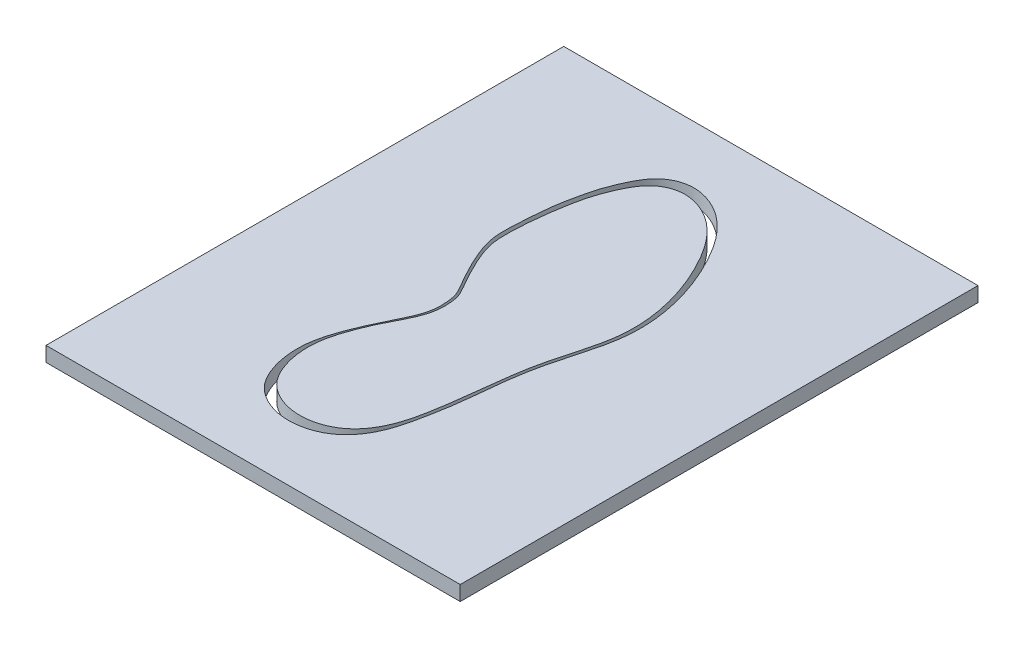
from build123d import *

# Parameters (mm, degrees)
SKETCH2_W           = 280
SKETCH2_H           = 350
BOSS_EXTRUDE1_DEPTH = 10
BOSS_EXTRUDE2_DEPTH = 10


with BuildPart() as part:
    # Sketch2 → Boss-Extrude1 (new body)
    with BuildSketch(Plane(origin=(0, 0, 0), x_dir=(1, 0, 0), z_dir=(0, 1, 0))):
        with Locations((53.146720033, 159.885236331)):
            Rectangle(SKETCH2_W, SKETCH2_H)
        with BuildLine():
            add(Edge.make_bspline(
                [(38.248600966, 296.026263032), (35.841020592, 295.869941907), (30.315231382, 294.730156235), (22.460147791, 290.044080709), (16.528277191, 282.038639037), (11.708875059, 271.886259135), (7.802809876, 261.380875489), (5.708938795, 251.324876792), (3.216561624, 240.260346119), (1.928014659, 225.673824985), (0.712749248, 210.75087153), (1.31423054, 195.838688163), (5.967698385, 183.24321844), (12.230321126, 170.56915956), (17.796150421, 160.872882757), (21.989284098, 153.758806103), (23.555393013, 145.317228798), (23.597290488, 134.395063889), (18.154871757, 121.812338834), (10.884376304, 107.467497451), (4.535178046, 92.56883593), (0.422338647, 78.059998778), (-0.403038286, 64.502575327), (1.792405648, 50.204252036), (10.05001283, 32.156777078), (33.615914627, 19.566209828), (60.487610209, 25.509547246), (77.825202179, 46.510166814), (82.549330907, 68.131539705), (86.888235098, 92.414146457), (88.538534523, 114.699319675), (92.23115196, 138.573944478), (98.779440352, 161.751601998), (104.76285143, 185.008356543), (104.068701573, 208.875006986), (98.468724938, 233.677829106), (87.788859377, 258.272999951), (73.425700915, 280.257280072), (56.240770364, 293.194014593), (43.887362588, 296.392380637), (38.248600966, 296.026263032)],
                knots=[0, 0, 0, 0, 0.011197393, 0.025870603, 0.041353186, 0.056716907, 0.078087435, 0.093206206, 0.104403599, 0.130762228, 0.161070934, 0.174020562, 0.19973575, 0.222489748, 0.23977795, 0.251849445, 0.260384497, 0.279363992, 0.301614912, 0.323052958, 0.354374743, 0.376673722, 0.3927372, 0.417093151, 0.443447683, 0.481983768, 0.531424973, 0.557124984, 0.604875648, 0.631667447, 0.67215217, 0.708490081, 0.743678815, 0.784132299, 0.819354322, 0.853415036, 0.901765615, 0.943420331, 0.973774737, 1, 1, 1, 1], degree=3))
        make_face(mode=Mode.SUBTRACT)
    extrude(amount=BOSS_EXTRUDE1_DEPTH)


with BuildPart() as body_2:
    # Sketch3 → Boss-Extrude2 (new body)
    with BuildSketch(Plane(origin=(0, 10, 0), x_dir=(1, 0, 0), z_dir=(0, 1, 0))):
        with BuildLine():
            add(Edge.make_bspline(
                [(39.071515045, 289.191713461), (36.784332144, 289.043204994), (31.534906689, 287.960394859), (24.071989816, 283.508731667), (18.439146861, 275.903112311), (13.850432865, 266.260251261), (10.187237166, 256.271347727), (6.900495891, 241.474251784), (4.569009583, 224.671633647), (3.428616136, 208.175997234), (3.978664415, 194.016708583), (9.642058387, 178.657772382), (17.246941244, 164.841941667), (23.622901917, 154.03845497), (25.123562514, 146.018566396), (25.009927703, 131.157514658), (14.607394388, 114.232181053), (7.084366737, 95.911043981), (3.130248724, 82.123160365), (2.354792895, 69.244424965), (4.437217225, 55.66077025), (12.283822076, 38.515531555), (34.666256883, 26.555934637), (60.214229715, 32.195900676), (76.631601184, 52.163311317), (83.310945784, 80.879622758), (86.203940337, 111.444244558), (90.317850666, 139.623714685), (96.587309825, 161.627157243), (102.257255546, 183.725585081), (101.601282412, 206.39780824), (96.280369037, 229.960784388), (86.134833138, 253.326091062), (72.489738375, 274.211185251), (56.16410166, 286.501072373), (44.428295364, 289.539533145), (39.071515045, 289.191713461)],
                knots=[0, 0, 0, 0, 0.011197393, 0.025870603, 0.041353186, 0.056716907, 0.078087435, 0.093206206, 0.130762228, 0.161070934, 0.174020562, 0.19973575, 0.23977795, 0.251849445, 0.260384497, 0.279363992, 0.323052958, 0.354374743, 0.376673722, 0.3927372, 0.417093151, 0.443447683, 0.481983768, 0.531424973, 0.557124984, 0.604875648, 0.67215217, 0.708490081, 0.743678815, 0.784132299, 0.819354322, 0.853415036, 0.901765615, 0.943420331, 0.973774737, 1, 1, 1, 1], degree=3))
        make_face()
    extrude(amount=-BOSS_EXTRUDE2_DEPTH)


solid = Compound([part.part, body_2.part])
